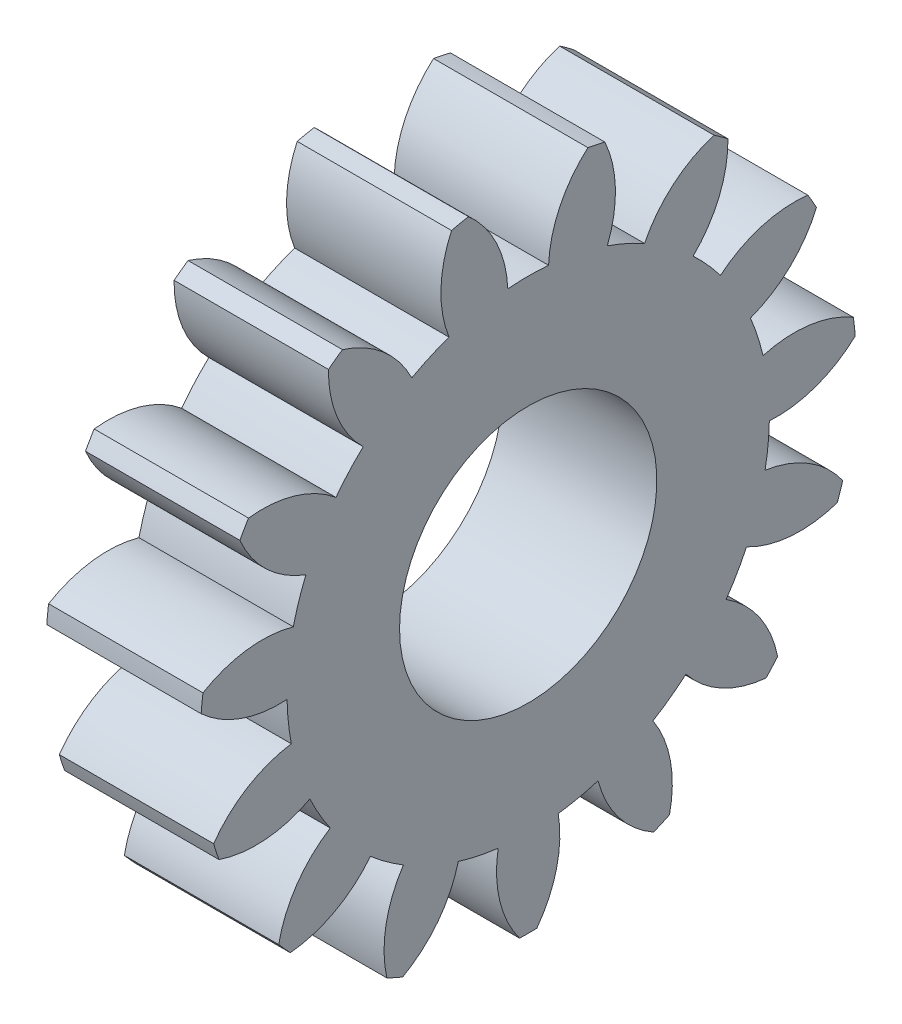
from build123d import *

# Parameters (mm, degrees)
BASPROSKE_W     = 12
BASPROSKE_H     = 25.5
TOOTHCUT_DEPTH  = 39.006578378
TEETHCUTS_COUNT = 15
TEETHCUTS_ANGLE = 336
BORSKE_R        = 10
BORE_DEPTH      = 50.0000508


with BuildPart() as part:
    # BasProSke → Base-Revolve (revolve)
    with BuildSketch(Plane(origin=(0, 0, 0), x_dir=(1, 0, 0), z_dir=(0, 1, 0)), mode=Mode.PRIVATE) as base_revolve_sk:
        with Locations((6, 12.75)):
            Rectangle(BASPROSKE_W, BASPROSKE_H)
    revolve(base_revolve_sk.sketch.rotate(Axis((-10, 0, 0), (1, 0, 0)), 180), axis=Axis((-10, 0, 0), (1, 0, 0)))

    # TooCutSke → ToothCut (cut, through all)
    with BuildSketch(Plane(origin=(0, 0, 0), x_dir=(0, 0, -1), z_dir=(1, 0, 0))):
        with BuildLine():
            ThreePointArc((1.584594428, 18.681918036), (0, 18.749), (-1.584594428, 18.681918036))
            ThreePointArc((-1.584594428, 18.681918036), (-2.465052499, 22.206073835), (-4.666912141, 25.095138498))
            ThreePointArc((-4.666912141, 25.095138498), (0, 25.5254), (4.666912141, 25.095138498))
            ThreePointArc((4.666912141, 25.095138498), (2.465052499, 22.206073835), (1.584594428, 18.681918036))
        make_face()
    toothcut = extrude(amount=TOOTHCUT_DEPTH, mode=Mode.SUBTRACT)

    # TeethCuts: ToothCut ×15 about axis
    teethcuts_axis = Axis((-10, 0, 0), (1, 0, 0))
    for i in range(1, TEETHCUTS_COUNT):
        add(toothcut.rotate(teethcuts_axis, i * TEETHCUTS_ANGLE / (TEETHCUTS_COUNT - 1)), mode=Mode.SUBTRACT)

    # BorSke → Bore (cut, symmetric)
    with BuildSketch(Plane(origin=(0, 0, 0), x_dir=(0, 0, -1), z_dir=(1, 0, 0))):
        with Locations(Location((0, 0, 0), (0, 0, 180))):
            Circle(BORSKE_R)
    extrude(amount=BORE_DEPTH, both=True, mode=Mode.SUBTRACT)


solid = part.part
